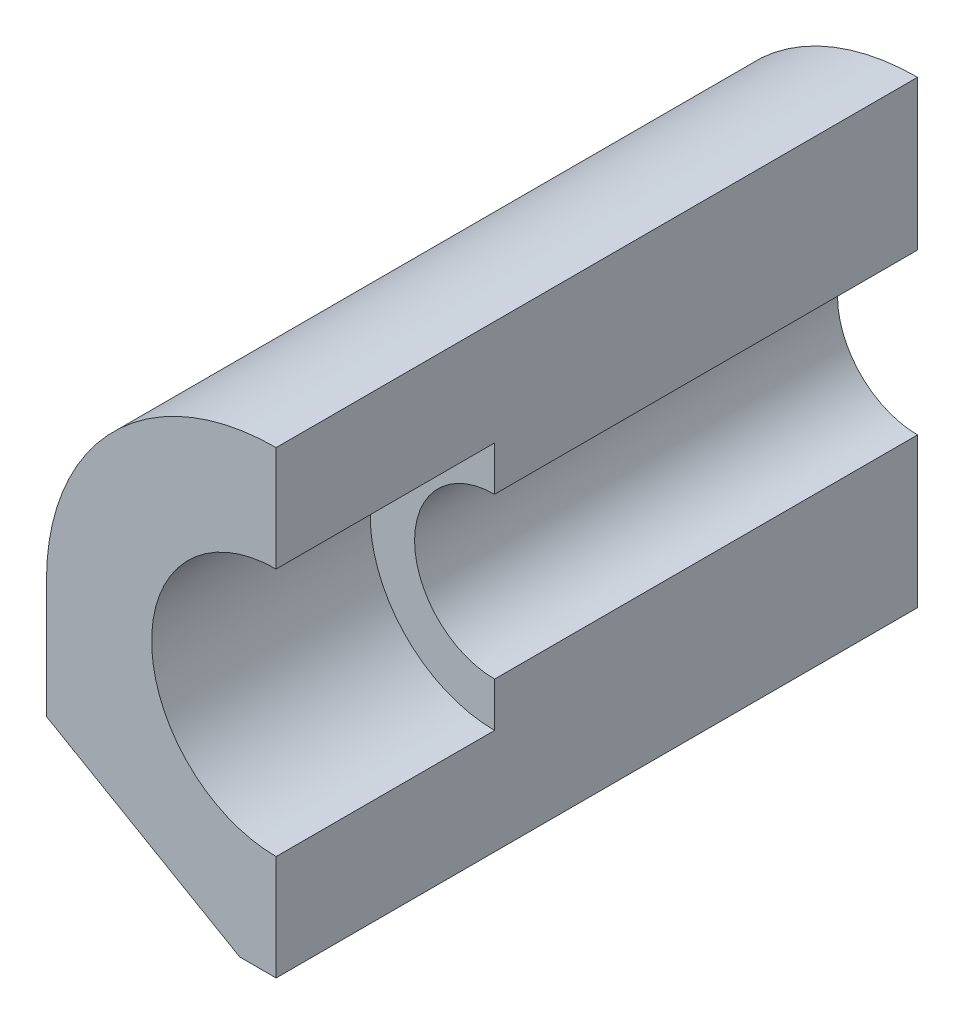
from build123d import *

# Parameters (mm, degrees)
BOSS_EXTRUDE1_DEPTH = 229
SKETCH3_R           = 44.45
CUT_EXTRUDE1_DEPTH  = 78
SKETCH4_R           = 28.575
CUT_EXTRUDE2_DEPTH  = 238.531050602


with BuildPart() as part:
    # Sketch2 → Boss-Extrude1 (new body)
    with BuildSketch(Plane.XY):
        with BuildLine():
            Line((0, 0), (0, 164))
            ThreePointArc((0, 164), (-57.982756057, 139.982756057), (-82, 82))
            Line((-82, 82), (-82, 39.837168574))
            Line((-82, 39.837168574), (-13, 0))
            Line((-13, 0), (0, 0))
        make_face()
    extrude(amount=BOSS_EXTRUDE1_DEPTH)

    # Sketch3 → Cut-Extrude1 (cut)
    with BuildSketch(Plane.XY.offset(229)):
        with Locations((0, 82)):
            Circle(SKETCH3_R)
    extrude(amount=-CUT_EXTRUDE1_DEPTH, mode=Mode.SUBTRACT)

    # Sketch4 → Cut-Extrude2 (cut, through all)
    with BuildSketch(Plane.XY.offset(151)):
        with Locations((0, 82)):
            Circle(SKETCH4_R)
    extrude(amount=-CUT_EXTRUDE2_DEPTH, mode=Mode.SUBTRACT)


solid = part.part
